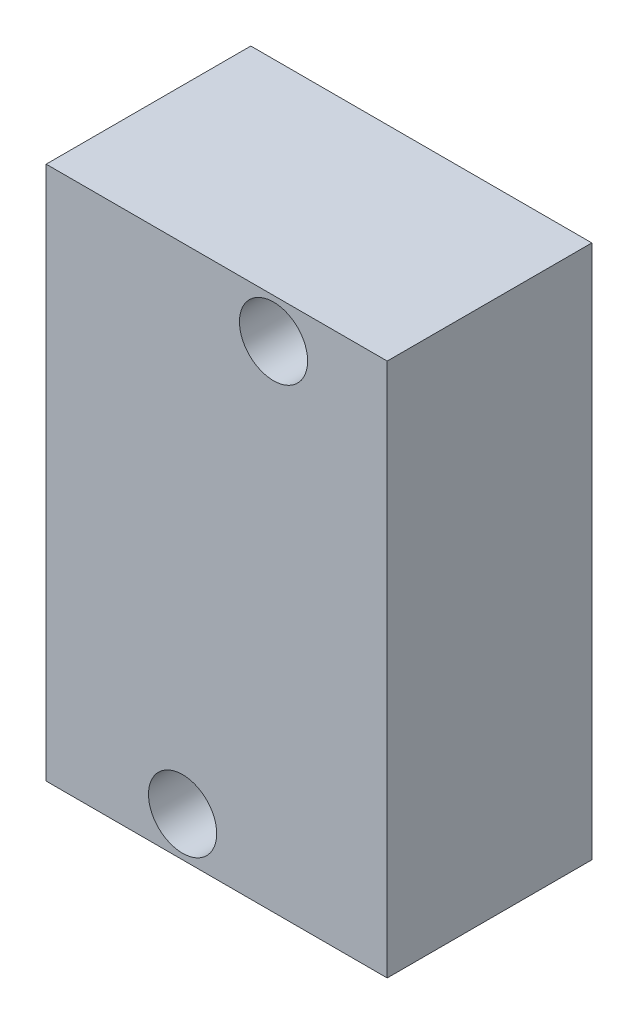
from build123d import *

# Parameters (mm, degrees)
SKETCH1_W           = 19.05
SKETCH1_H           = 29.845
BOSS_EXTRUDE1_DEPTH = 11.43
SKETCH2_R           = 1.905
CUT_EXTRUDE1_DEPTH  = 11.43


with BuildPart() as part:
    # Sketch1 → Boss-Extrude1 (new body)
    with BuildSketch(Plane.XY):
        with Locations((3.315331492, -9.186450276)):
            Rectangle(SKETCH1_W, SKETCH1_H)
    extrude(amount=BOSS_EXTRUDE1_DEPTH)

    # Sketch2 → Cut-Extrude1 (cut)
    with BuildSketch(Plane.XY.offset(11.43)):
        with Locations((6.490331492, 3.513549724)):
            Circle(SKETCH2_R)
        with Locations((1.410331492, -21.886450276)):
            Circle(SKETCH2_R)
    extrude(amount=-CUT_EXTRUDE1_DEPTH, mode=Mode.SUBTRACT)


solid = part.part
